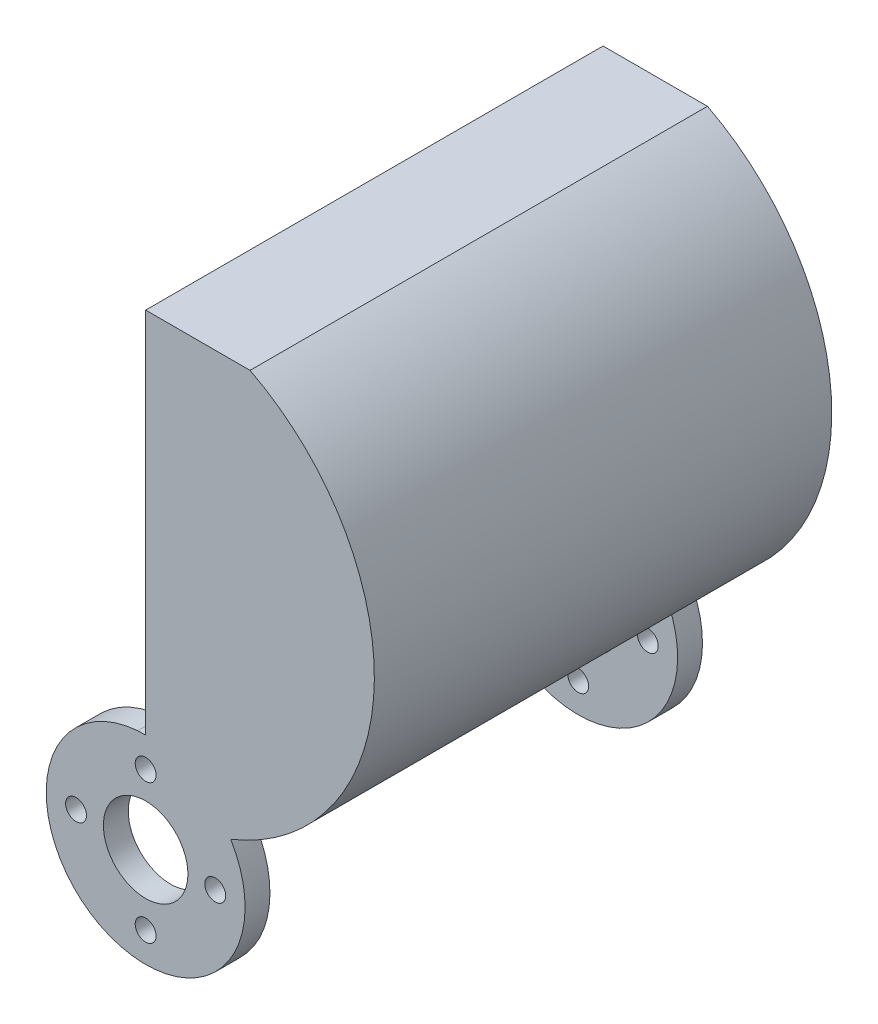
from build123d import *

# Parameters (mm, degrees)
SKETCH1_R           = 4.25
SKETCH1_R_2         = 1.05
BOSS_EXTRUDE1_DEPTH = 23
BOSS_EXTRUDE3_DEPTH = 2
SKETCH4_W           = 21
SKETCH4_H           = 41
CUT_EXTRUDE1_DEPTH  = 50.288548817
BOSS_EXTRUDE4_START = 42
BOSS_EXTRUDE4_DEPTH = 42
CUT_EXTRUDE4_REACH  = 70.367


with BuildPart() as part:
    # Sketch1 → Boss-Extrude1 (new, symmetric)
    with BuildSketch(Plane.XY):
        with BuildLine():
            Line((-0.798015115, 9.968107738), (11.201984885, 9.968107738))
            ThreePointArc((11.201984885, 9.968107738), (19.90012903, 28.53283063), (7.687881875, 45))
            Line((7.687881875, 45), (3.464101615, 45))
            Line((3.464101615, 45), (0, 47))
            Line((0, 47), (10.5, 47))
            ThreePointArc((10.5, 47), (22.975048867, 25.465576737), (8.550692083, 5.18513885))
            ThreePointArc((8.550692083, 5.18513885), (-4.554689659, -8.902516617), (-0.798015115, 9.968107738))
        make_face()
        Circle(SKETCH1_R, mode=Mode.SUBTRACT)
        with Locations((0, 7)):
            Circle(SKETCH1_R_2, mode=Mode.SUBTRACT)
        with Locations((7, 0)):
            Circle(SKETCH1_R_2, mode=Mode.SUBTRACT)
        with Locations((0, -7)):
            Circle(SKETCH1_R_2, mode=Mode.SUBTRACT)
        with Locations((-7, 0)):
            Circle(SKETCH1_R_2, mode=Mode.SUBTRACT)
    extrude(amount=BOSS_EXTRUDE1_DEPTH, both=True)

    # Sketch3 → Boss-Extrude3 (add)
    with BuildSketch(Plane.XY.offset(23)):
        with BuildLine():
            Line((0, 47), (3.464101615, 45))
            Line((3.464101615, 45), (7.687881875, 45))
            ThreePointArc((7.687881875, 45), (19.90012903, 28.53283063), (11.201984885, 9.968107738))
            Line((11.201984885, 9.968107738), (0, 9.968107738))
            Line((0, 9.968107738), (0, 47))
        make_face()
    boss_extrude3 = extrude(amount=-BOSS_EXTRUDE3_DEPTH)

    # Mirror1: Boss-Extrude3 across plane
    add(boss_extrude3.mirror(Plane.XY))

    # Sketch4 → Cut-Extrude1 (cut, through all)
    with BuildSketch(Plane(origin=(0, 9.968107738, 0), x_dir=(1, 0, 0), z_dir=(0, 1, 0))):
        Rectangle(SKETCH4_W, SKETCH4_H)
    extrude(amount=-CUT_EXTRUDE1_DEPTH, mode=Mode.SUBTRACT)

    # Sketch6 → Boss-Extrude4 (add)
    with BuildSketch(Plane.XY.offset(-21).offset(BOSS_EXTRUDE4_START)):
        with BuildLine():
            Line((0, 22.833916422), (0, 19.973613057))
            ThreePointArc((0, 19.973613057), (8.195306737, 18.214888581), (14.947380695, 13.248434961))
            ThreePointArc((14.947380695, 13.248434961), (15.873509775, 14.369790734), (16.715701567, 15.555483287))
            ThreePointArc((16.715701567, 15.555483287), (9.115786688, 20.935380871), (0, 22.833916422))
        make_face()
    extrude(amount=-BOSS_EXTRUDE4_DEPTH)

    # Cut-Extrude4: up to this face of the body (flat: up to its plane)
    cut_extrude4_end = Plane(part.part.faces().sort_by_distance((6.103448613, 14.332073809, -21))[0])
    # Sketch7 → Cut-Extrude4 (cut, up to the picked face)
    with BuildSketch(Plane(origin=(0, 0, 21), x_dir=(-1, 0, 0), z_dir=(0, 0, -1)), mode=Mode.PRIVATE) as cut_extrude4_sk1:
        with BuildLine():
            Line((0, 19.973613057), (0, 9.968107738))
            ThreePointArc((0, 9.968107738), (-4.88859678, 8.68704745), (-8.520668778, 5.173139806))
            ThreePointArc((-8.520668778, 5.173139806), (-12.966457487, 7.54001363), (-16.790465857, 10.817831339))
            ThreePointArc((-16.790465857, 10.817831339), (-9.562270684, 17.535911665), (0, 19.973613057))
        make_face()
    cut_extrude4_tool1 = split(extrude(cut_extrude4_sk1.sketch, amount=CUT_EXTRUDE4_REACH, mode=Mode.PRIVATE), bisect_by=cut_extrude4_end, keep=Keep.BOTH, mode=Mode.PRIVATE)
    add(cut_extrude4_tool1.solids().sort_by(Axis((7.299259, 12.896939, 21), (0, 0, -1)))[0], mode=Mode.SUBTRACT)


solid = part.part
